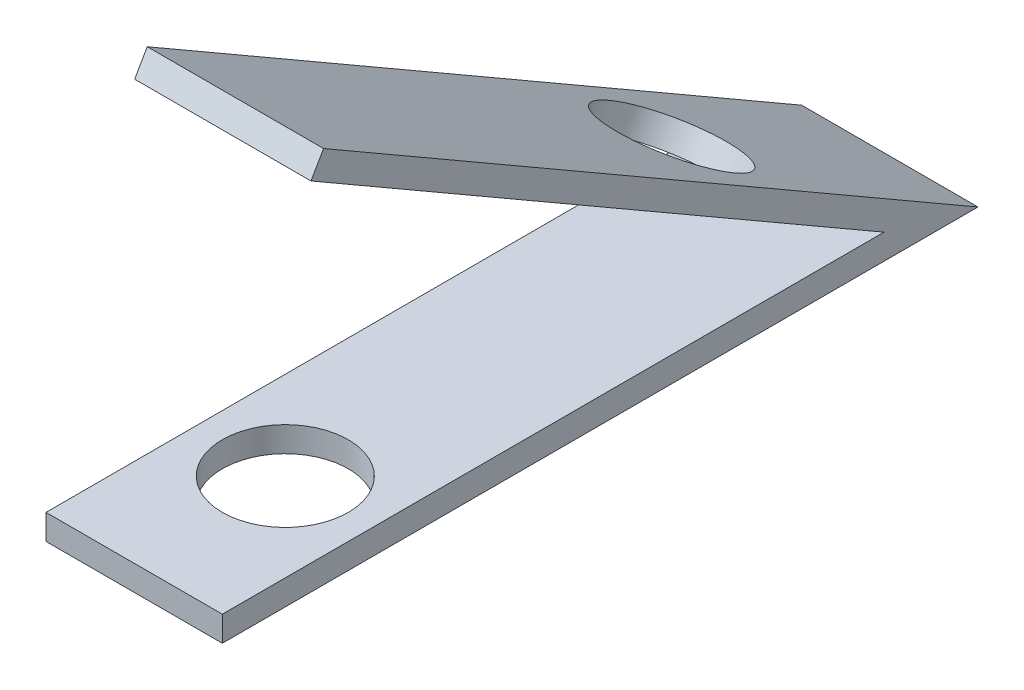
from build123d import *

# Parameters (mm, degrees)
BOSS_EXTRUDE1_DEPTH = 70
SKETCH2_R           = 25
CUT_EXTRUDE1_DEPTH  = 10
SKETCH5_R           = 25
CUT_EXTRUDE3_DEPTH  = 300


with BuildPart() as part:
    # Sketch1 → Boss-Extrude1 (new body)
    with BuildSketch(Plane(origin=(0, 0, 0), x_dir=(0, 0, -1), z_dir=(1, 0, 0))):
        Polygon((-227.48711306, 131.339745962), (0, 0), (-262.679491924, 0), (-262.679491924, -10), (37.320508076, -10), (-222.48711306, 140), align=None)
    extrude(amount=BOSS_EXTRUDE1_DEPTH)

    # Sketch2 → Cut-Extrude1 (cut)
    with BuildSketch(Plane(origin=(0, 8.660254038, -5), x_dir=(1, 0, 0), z_dir=(0, 0.8660254037844419, -0.4999999999999945))):
        with Locations(Location((35, -62.679491924, 0), (0, 0, 270))):
            Circle(SKETCH2_R)
    extrude(amount=-CUT_EXTRUDE1_DEPTH, mode=Mode.SUBTRACT)

    # Sketch5 → Cut-Extrude3 (cut)
    with BuildSketch(Plane(origin=(0, 0, 0), x_dir=(1, 0, 0), z_dir=(0, 1, 0))):
        with Locations(Location((35, -202.679491924, 0), (0, 0, 270))):
            Circle(SKETCH5_R)
    extrude(amount=-CUT_EXTRUDE3_DEPTH, mode=Mode.SUBTRACT)


solid = part.part
